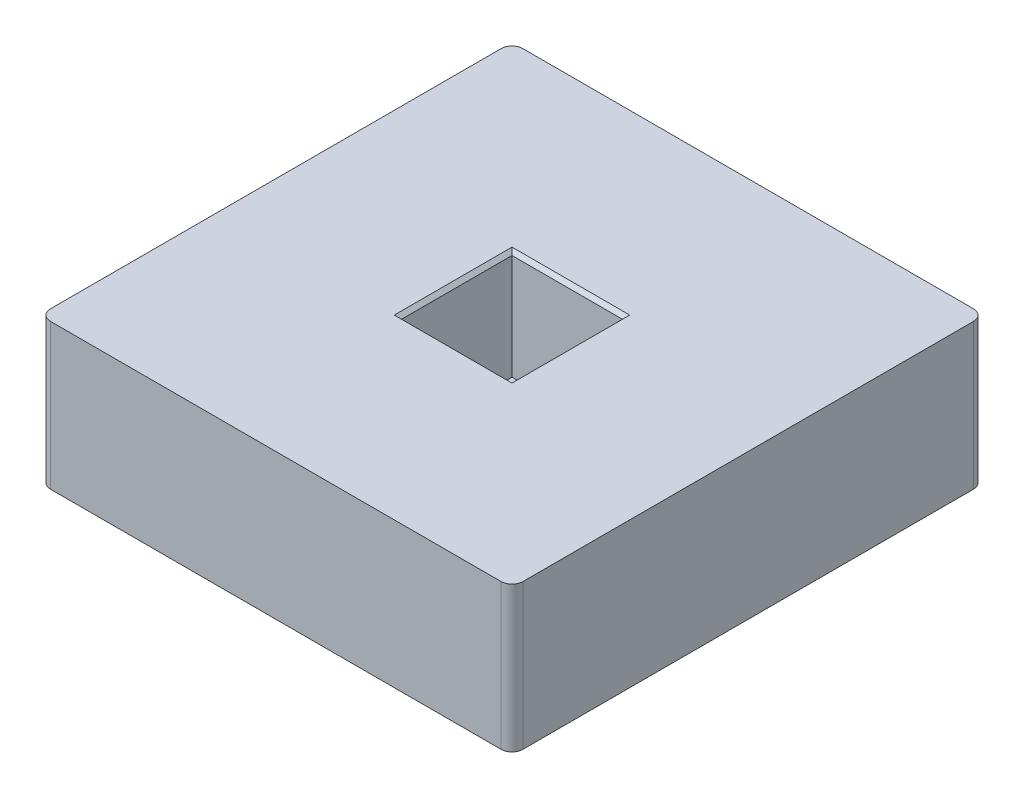
from build123d import *

# Parameters (mm, degrees)
SKETCH1_W           = 130
SKETCH1_H           = 130
BOSS_EXTRUDE1_DEPTH = 40
FILLET1_R           = 3
SKETCH2_W           = 30.4
SKETCH2_H           = 30.4
CUT_EXTRUDE1_DEPTH  = 30
CHAMFER1_SIZE       = 1


with BuildPart() as part:
    # Sketch1 → Boss-Extrude1 (new body)
    with BuildSketch(Plane(origin=(0, 0, 0), x_dir=(1, 0, 0), z_dir=(0, 1, 0))):
        Rectangle(SKETCH1_W, SKETCH1_H)
    extrude(amount=BOSS_EXTRUDE1_DEPTH)

    # Fillet1
    fillet1_edges = [part.edges().sort_by_distance(p)[0] for p in [
        (65, 20, 65),
        (-65, 20, 65),
        (-65, 20, -65),
        (65, 20, -65),
    ]]
    fillet(fillet1_edges, radius=FILLET1_R)

    # Sketch2 → Cut-Extrude1 (cut)
    with BuildSketch(Plane(origin=(0, 40, 0), x_dir=(1, 0, 0), z_dir=(0, 1, 0))):
        Rectangle(SKETCH2_W, SKETCH2_H)
    extrude(amount=-CUT_EXTRUDE1_DEPTH, mode=Mode.SUBTRACT)

    # Chamfer1
    chamfer1_edges = [part.edges().sort_by_distance(p)[0] for p in [
        (15.2, 40, 0),
        (0, 40, -15.2),
        (-15.2, 40, 0),
        (0, 40, 15.2),
    ]]
    chamfer(chamfer1_edges, length=CHAMFER1_SIZE)


solid = part.part
